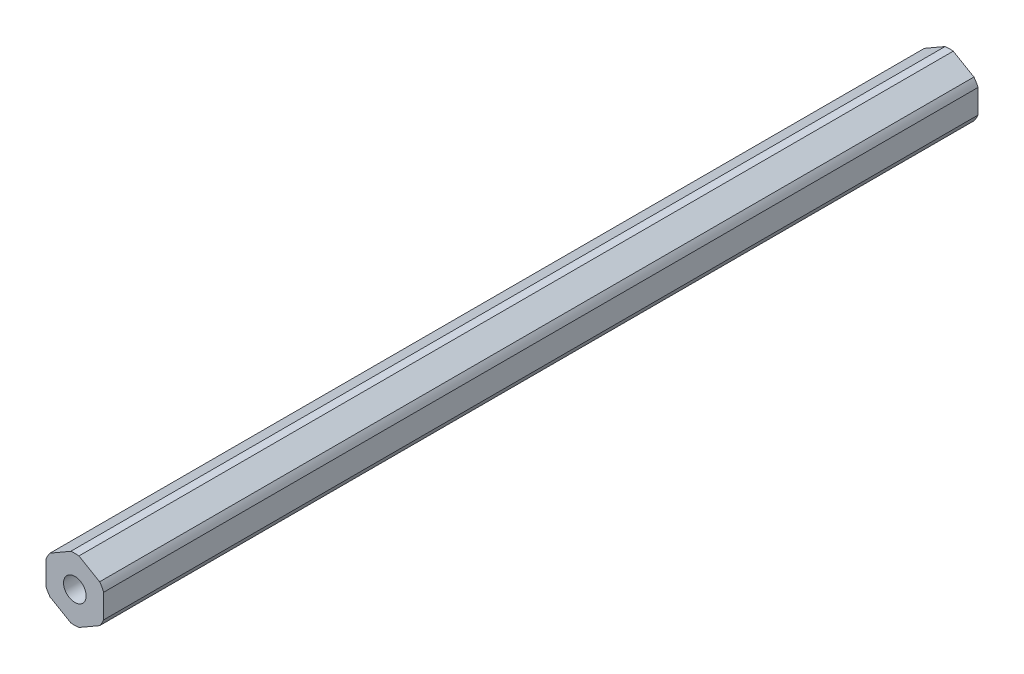
from build123d import *

# Parameters (mm, degrees)
BOSS_EXTRUDE1_DEPTH     = 192.405
CUT_EXTRUDE1_DEPTH      = 193.632479478
CUT_EXTRUDE1_DEPTH_BACK = 193.632479478
SKETCH2_R               = 2.4892


with BuildPart() as part:
    # Sketch1 → Boss-Extrude1 (new body)
    with BuildSketch(Plane.XY):
        with BuildLine():
            Line((-0.893039494, 6.816751826), (-5.456960506, 4.181770802))
            ThreePointArc((-5.456960506, 4.181770802), (-5.953924651, 3.4375), (-6.35, 2.634981025))
            Line((-6.35, 2.634981025), (-6.35, -2.634981025))
            ThreePointArc((-6.35, -2.634981025), (-5.953924651, -3.4375), (-5.456960506, -4.181770802))
            Line((-5.456960506, -4.181770802), (-0.893039494, -6.816751826))
            ThreePointArc((-0.893039494, -6.816751826), (0, -6.875), (0.893039494, -6.816751826))
            Line((0.893039494, -6.816751826), (5.456960506, -4.181770802))
            ThreePointArc((5.456960506, -4.181770802), (5.953924651, -3.4375), (6.35, -2.634981025))
            Line((6.35, -2.634981025), (6.35, 2.634981025))
            ThreePointArc((6.35, 2.634981025), (5.953924651, 3.4375), (5.456960506, 4.181770802))
            Line((5.456960506, 4.181770802), (0.893039494, 6.816751826))
            ThreePointArc((0.893039494, 6.816751826), (0, 6.875), (-0.893039494, 6.816751826))
        make_face()
    extrude(amount=BOSS_EXTRUDE1_DEPTH)

    # Sketch2 → Cut-Extrude1 (cut, two sides: drawn at the far end of the back side and taken through both)
    with BuildSketch(Plane(origin=(0, 0, 0), x_dir=(-1, 0, 0), z_dir=(0, 0, -1)).offset(-CUT_EXTRUDE1_DEPTH_BACK)):
        Circle(SKETCH2_R)
    extrude(amount=CUT_EXTRUDE1_DEPTH + CUT_EXTRUDE1_DEPTH_BACK, mode=Mode.SUBTRACT)


solid = part.part
